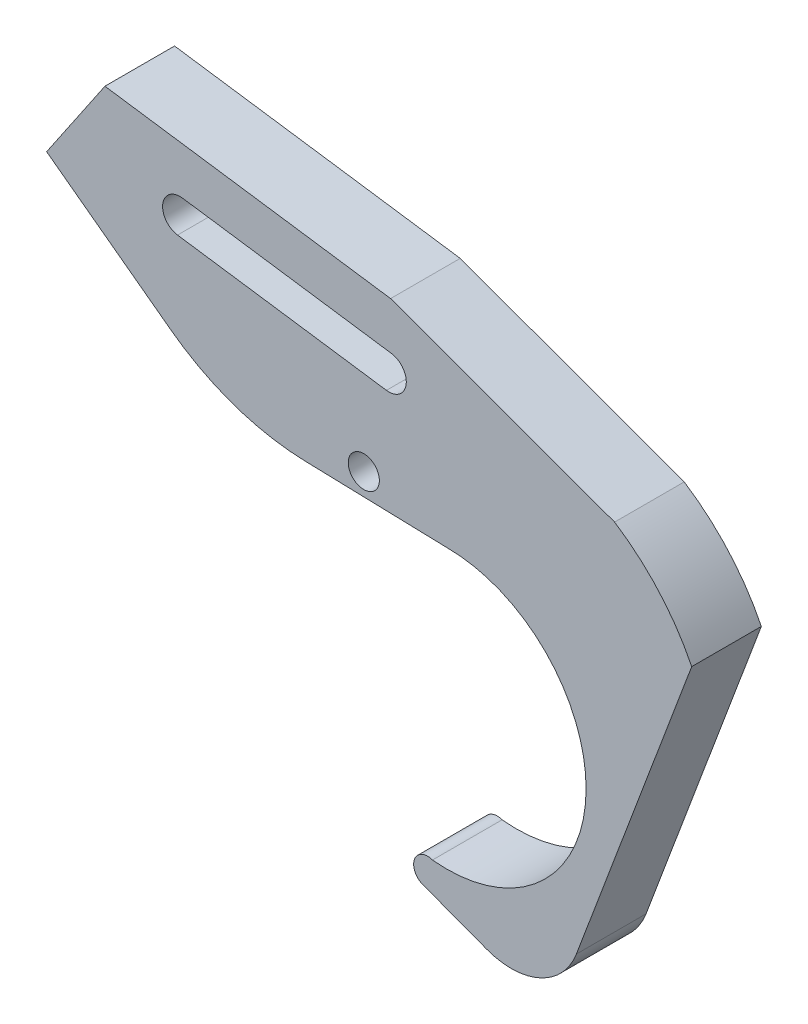
from build123d import *

# Parameters (mm, degrees)
SKETCH1_R           = 2.838382548
BOSS_EXTRUDE2_DEPTH = 12.7


with BuildPart() as part:
    # Sketch1 → Boss-Extrude2 (new body)
    with BuildSketch(Plane.XY):
        with BuildLine():
            Line((-26.824587008, 88.76822773), (25.274610138, 81.274279665))
            Line((25.274610138, 81.274279665), (66.134216336, 66.398380962))
            ThreePointArc((66.134216336, 66.398380962), (74.236045161, 59.4504343), (80.201058977, 50.599886109))
            Line((80.201058977, 50.599886109), (59.165982949, -5.321540814))
            ThreePointArc((59.165982949, -5.321540814), (52.522719394, -12.417211597), (42.807825757, -12.737111817))
            Line((42.807825757, -12.737111817), (31.132290646, -8.345310995))
            ThreePointArc((31.132290646, -8.345310995), (29.649176446, -5.073679556), (32.920807884, -3.590565356))
            ThreePointArc((32.920807884, -3.590565356), (34.228479037, -3.692067968), (35.539646393, -3.725932272))
            ThreePointArc((35.539646393, -3.725932272), (59.225238989, 12.500589471), (52.648250228, 40.447870615))
            ThreePointArc((52.648250228, 40.447870615), (44.71312465, 45.359660325), (35.539646393, 47.074067728))
            Line((35.539646393, 47.074067728), (9.696061009, 47.807757753))
            ThreePointArc((9.696061009, 47.807757753), (-3.214919538, 50.169926542), (-14.819759488, 56.301887878))
            Line((-14.819759488, 56.301887878), (-37.452223969, 73.106391791))
            Line((-37.452223969, 73.106391791), (-26.824587008, 88.76822773))
        make_face()
        with Locations((20.390142766, 51.502972215)):
            Circle(SKETCH1_R, mode=Mode.SUBTRACT)
        with BuildLine():
            Line((24.516957739, 66.398380962), (-13.583042261, 71.878684632))
            ThreePointArc((-13.583042261, 71.878684632), (-16.273658443, 75.473379968), (-12.678963107, 78.16399615))
            Line((-12.678963107, 78.16399615), (25.421036893, 72.68369248))
            ThreePointArc((25.421036893, 72.68369248), (28.111653075, 69.088997144), (24.516957739, 66.398380962))
        make_face(mode=Mode.SUBTRACT)
    extrude(amount=BOSS_EXTRUDE2_DEPTH)


solid = part.part
